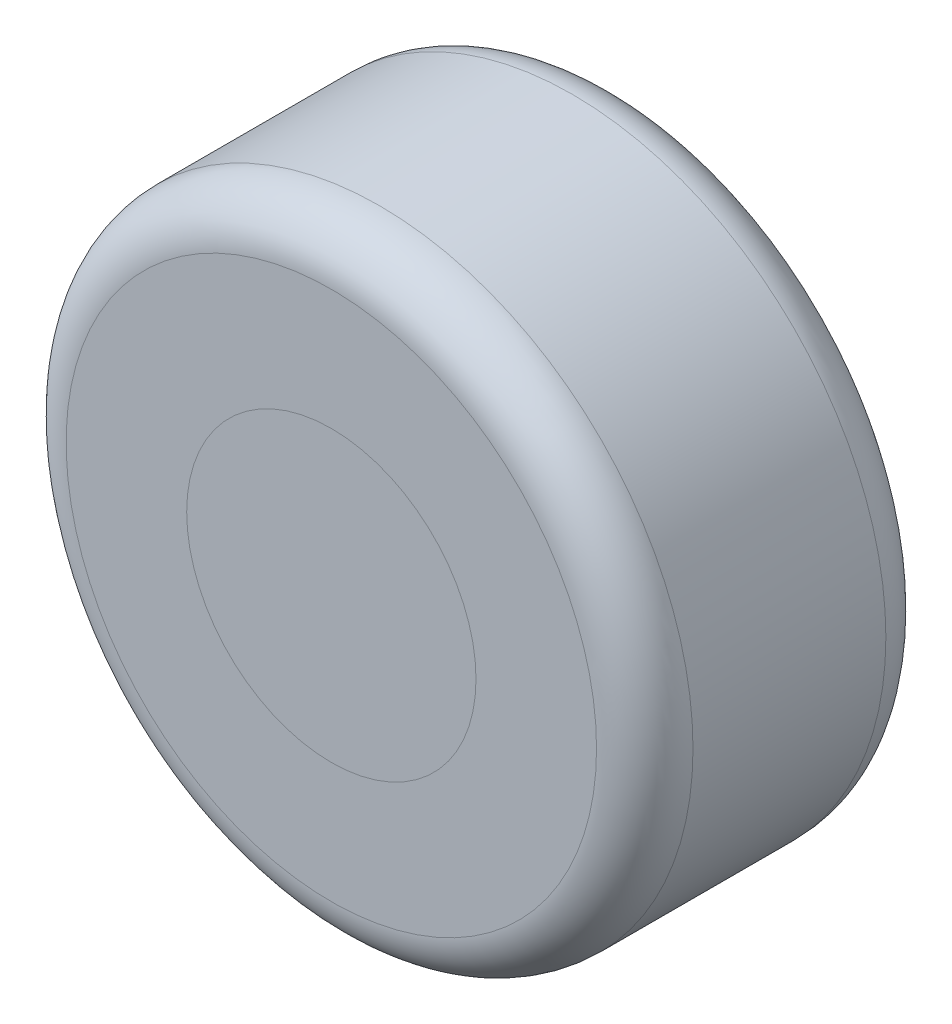
from build123d import *

# Parameters (mm, degrees)
SKETCH1_R           = 65
SKETCH1_R_2         = 30
BOSS_EXTRUDE1_DEPTH = 60
FILLET1_R           = 10
SKETCH2_R           = 30
BOSS_EXTRUDE3_DEPTH = 60


with BuildPart() as part:
    # Sketch1 → Boss-Extrude1 (new body)
    with BuildSketch(Plane.XY):
        Circle(SKETCH1_R)
        Circle(SKETCH1_R_2, mode=Mode.SUBTRACT)
    extrude(amount=-BOSS_EXTRUDE1_DEPTH)

    # Fillet1
    fillet1_edges = [part.edges().sort_by_distance(p)[0] for p in [
        (-65, 0, 0),
        (-65, 0, -60),
    ]]
    fillet(fillet1_edges, radius=FILLET1_R)


with BuildPart() as body_2:
    # Sketch2 → Boss-Extrude3 (new body)
    with BuildSketch(Plane.XY):
        Circle(SKETCH2_R)
    extrude(amount=-BOSS_EXTRUDE3_DEPTH)


solid = Compound([part.part, body_2.part])
